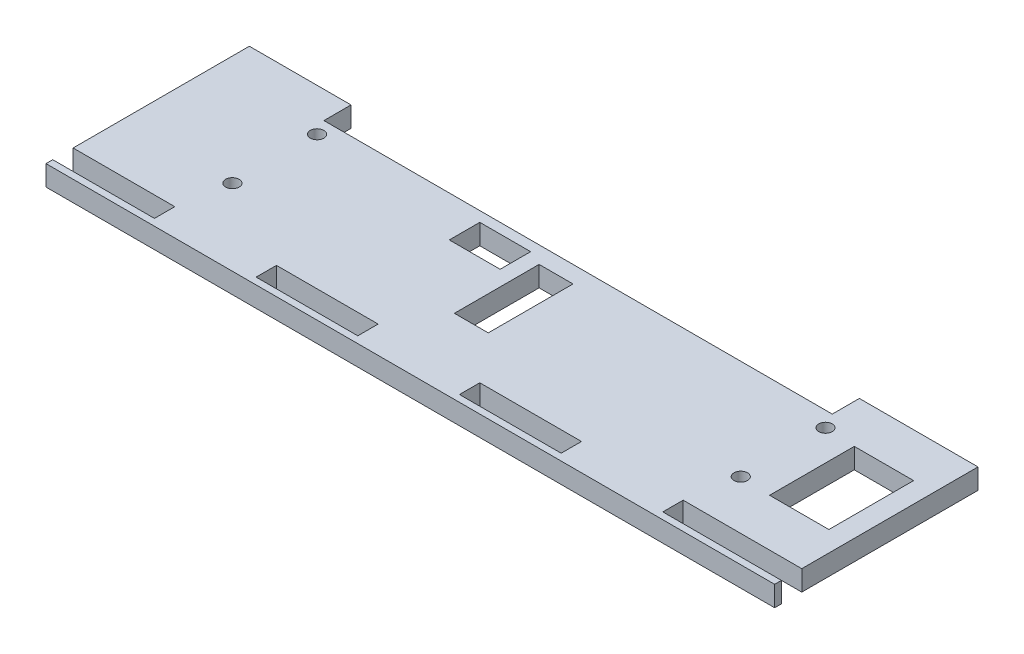
from build123d import *

# Parameters (mm, degrees)
SKETCH_1_W      = 30
SKETCH_1_H      = 6
SKETCH_1_R      = 2
SKETCH_1_W_2    = 10
SKETCH_1_H_2    = 25
SKETCH_1_W_3    = 15
SKETCH_1_H_3    = 9
SKETCH_1_W_4    = 17.5
EXTRUDE_1_DEPTH = 6


with BuildPart() as part:
    # Эскиз1 → Бобышка-Вытянуть1 (new body)
    with BuildSketch(Plane(origin=(0, 0, 0), x_dir=(1, 0, 0), z_dir=(0, 1, 0))):
        Polygon((-77.5, 25), (-107.5, 25), (-107.5, -27), (-77.5, -27), (-77.5, -33), (-107.5, -33), (-107.5, -35), (107.5, -35), (107.5, -33), (72.5, -33), (72.5, -27), (107.5, -27), (107.5, 25), (72.5, 25), (72.5, 17), (-77.5, 17), align=None)
        with Locations((-32.5, -30)):
            Rectangle(SKETCH_1_W, SKETCH_1_H, mode=Mode.SUBTRACT)
        with Locations(Location((-75, -12.5, 0), (0, 0, 270))):
            Circle(SKETCH_1_R, mode=Mode.SUBTRACT)
        with Locations((27.5, -30)):
            Rectangle(SKETCH_1_W, SKETCH_1_H, mode=Mode.SUBTRACT)
        with Locations(Location((75, -12.5, 0), (0, 0, 270))):
            Circle(SKETCH_1_R, mode=Mode.SUBTRACT)
        with Locations((-4, -0.5)):
            Rectangle(SKETCH_1_W_2, SKETCH_1_H_2, mode=Mode.SUBTRACT)
        with Locations((-21, 9.5)):
            Rectangle(SKETCH_1_W_3, SKETCH_1_H_3, mode=Mode.SUBTRACT)
        with Locations(Location((-75, 12.5, 0), (0, 0, 270))):
            Circle(SKETCH_1_R, mode=Mode.SUBTRACT)
        with Locations((92.75, -0.5)):
            Rectangle(SKETCH_1_W_4, SKETCH_1_H_2, mode=Mode.SUBTRACT)
        with Locations(Location((75, 12.5, 0), (0, 0, 270))):
            Circle(SKETCH_1_R, mode=Mode.SUBTRACT)
    extrude(amount=EXTRUDE_1_DEPTH)


solid = part.part
